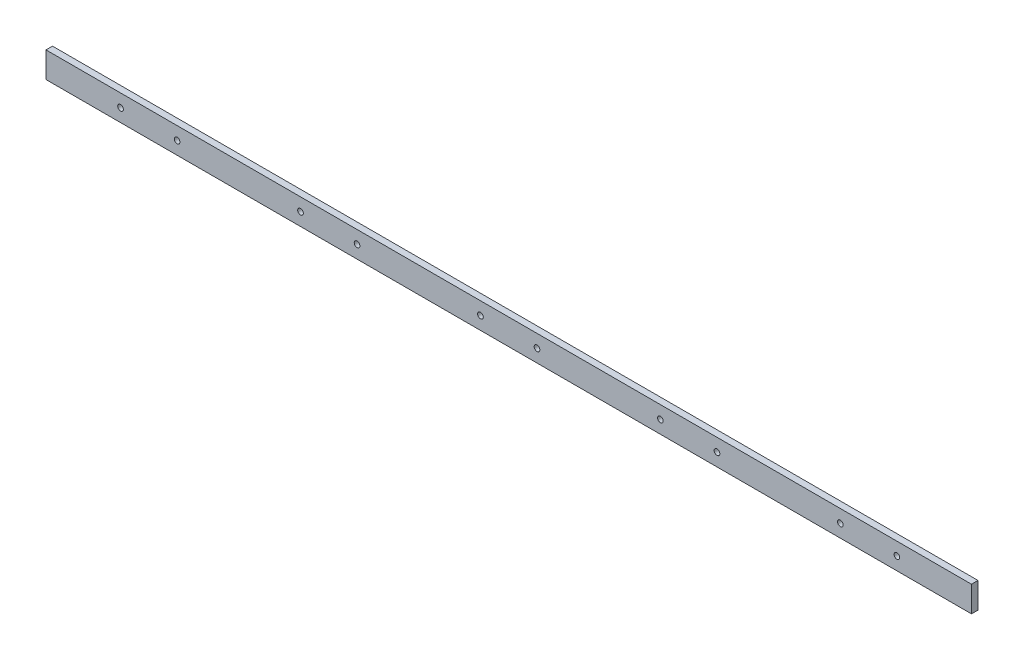
from build123d import *

# Parameters (mm, degrees)
SKETCH1_W           = 900
SKETCH1_H           = 25
BOSS_EXTRUDE1_DEPTH = 6.35
CUT_EXTRUDE1_REACH  = 902.37
SKETCH2_R           = 2.75


with BuildPart() as part:
    # Sketch1 → Boss-Extrude1 (new body)
    with BuildSketch(Plane.XY):
        with Locations((450, 12.5)):
            Rectangle(SKETCH1_W, SKETCH1_H)
    extrude(amount=BOSS_EXTRUDE1_DEPTH)

    # Sketch2 → Cut-Extrude1 (cut, up to next)
    with BuildSketch(Plane.XY.offset(6.35), mode=Mode.PRIVATE) as cut_extrude1_sk1:
        with Locations((477.5, 12.5)):
            Circle(SKETCH2_R)
    cut_extrude1_tool1 = extrude(cut_extrude1_sk1.sketch, amount=-CUT_EXTRUDE1_REACH, mode=Mode.PRIVATE) & part.part
    # Sketch2 → Cut-Extrude1 (cut, up to next)
    with BuildSketch(Plane.XY.offset(6.35), mode=Mode.PRIVATE) as cut_extrude1_sk2:
        with Locations((422.5, 12.5)):
            Circle(SKETCH2_R)
    cut_extrude1_tool2 = extrude(cut_extrude1_sk2.sketch, amount=-CUT_EXTRUDE1_REACH, mode=Mode.PRIVATE) & part.part
    # Sketch2 → Cut-Extrude1 (cut, up to next)
    with BuildSketch(Plane.XY.offset(6.35), mode=Mode.PRIVATE) as cut_extrude1_sk3:
        with Locations((652.5, 12.5)):
            Circle(SKETCH2_R)
    cut_extrude1_tool3 = extrude(cut_extrude1_sk3.sketch, amount=-CUT_EXTRUDE1_REACH, mode=Mode.PRIVATE) & part.part
    # Sketch2 → Cut-Extrude1 (cut, up to next)
    with BuildSketch(Plane.XY.offset(6.35), mode=Mode.PRIVATE) as cut_extrude1_sk4:
        with Locations((597.5, 12.5)):
            Circle(SKETCH2_R)
    cut_extrude1_tool4 = extrude(cut_extrude1_sk4.sketch, amount=-CUT_EXTRUDE1_REACH, mode=Mode.PRIVATE) & part.part
    # Sketch2 → Cut-Extrude1 (cut, up to next)
    with BuildSketch(Plane.XY.offset(6.35), mode=Mode.PRIVATE) as cut_extrude1_sk5:
        with Locations((827.5, 12.5)):
            Circle(SKETCH2_R)
    cut_extrude1_tool5 = extrude(cut_extrude1_sk5.sketch, amount=-CUT_EXTRUDE1_REACH, mode=Mode.PRIVATE) & part.part
    # Sketch2 → Cut-Extrude1 (cut, up to next)
    with BuildSketch(Plane.XY.offset(6.35), mode=Mode.PRIVATE) as cut_extrude1_sk6:
        with Locations((772.5, 12.5)):
            Circle(SKETCH2_R)
    cut_extrude1_tool6 = extrude(cut_extrude1_sk6.sketch, amount=-CUT_EXTRUDE1_REACH, mode=Mode.PRIVATE) & part.part
    # Sketch2 → Cut-Extrude1 (cut, up to next)
    with BuildSketch(Plane.XY.offset(6.35), mode=Mode.PRIVATE) as cut_extrude1_sk7:
        with Locations(Location((127.5, 12.5, 0), (0, 0, 180))):
            Circle(SKETCH2_R)
    cut_extrude1_tool7 = extrude(cut_extrude1_sk7.sketch, amount=-CUT_EXTRUDE1_REACH, mode=Mode.PRIVATE) & part.part
    # Sketch2 → Cut-Extrude1 (cut, up to next)
    with BuildSketch(Plane.XY.offset(6.35), mode=Mode.PRIVATE) as cut_extrude1_sk8:
        with Locations(Location((72.5, 12.5, 0), (0, 0, 180))):
            Circle(SKETCH2_R)
    cut_extrude1_tool8 = extrude(cut_extrude1_sk8.sketch, amount=-CUT_EXTRUDE1_REACH, mode=Mode.PRIVATE) & part.part
    # Sketch2 → Cut-Extrude1 (cut, up to next)
    with BuildSketch(Plane.XY.offset(6.35), mode=Mode.PRIVATE) as cut_extrude1_sk9:
        with Locations(Location((247.5, 12.5, 0), (0, 0, 180))):
            Circle(SKETCH2_R)
    cut_extrude1_tool9 = extrude(cut_extrude1_sk9.sketch, amount=-CUT_EXTRUDE1_REACH, mode=Mode.PRIVATE) & part.part
    # Sketch2 → Cut-Extrude1 (cut, up to next)
    with BuildSketch(Plane.XY.offset(6.35), mode=Mode.PRIVATE) as cut_extrude1_sk10:
        with Locations(Location((302.5, 12.5, 0), (0, 0, 180))):
            Circle(SKETCH2_R)
    cut_extrude1_tool10 = extrude(cut_extrude1_sk10.sketch, amount=-CUT_EXTRUDE1_REACH, mode=Mode.PRIVATE) & part.part
    add(cut_extrude1_tool1.solids().sort_by_distance((477.5, 12.5, 6.35))[0], mode=Mode.SUBTRACT)
    add(cut_extrude1_tool2.solids().sort_by_distance((422.5, 12.5, 6.35))[0], mode=Mode.SUBTRACT)
    add(cut_extrude1_tool3.solids().sort_by_distance((652.5, 12.5, 6.35))[0], mode=Mode.SUBTRACT)
    add(cut_extrude1_tool4.solids().sort_by_distance((597.5, 12.5, 6.35))[0], mode=Mode.SUBTRACT)
    add(cut_extrude1_tool5.solids().sort_by_distance((827.5, 12.5, 6.35))[0], mode=Mode.SUBTRACT)
    add(cut_extrude1_tool6.solids().sort_by_distance((772.5, 12.5, 6.35))[0], mode=Mode.SUBTRACT)
    add(cut_extrude1_tool7.solids().sort_by_distance((127.5, 12.5, 6.35))[0], mode=Mode.SUBTRACT)
    add(cut_extrude1_tool8.solids().sort_by_distance((72.5, 12.5, 6.35))[0], mode=Mode.SUBTRACT)
    add(cut_extrude1_tool9.solids().sort_by_distance((247.5, 12.5, 6.35))[0], mode=Mode.SUBTRACT)
    add(cut_extrude1_tool10.solids().sort_by_distance((302.5, 12.5, 6.35))[0], mode=Mode.SUBTRACT)


solid = part.part
